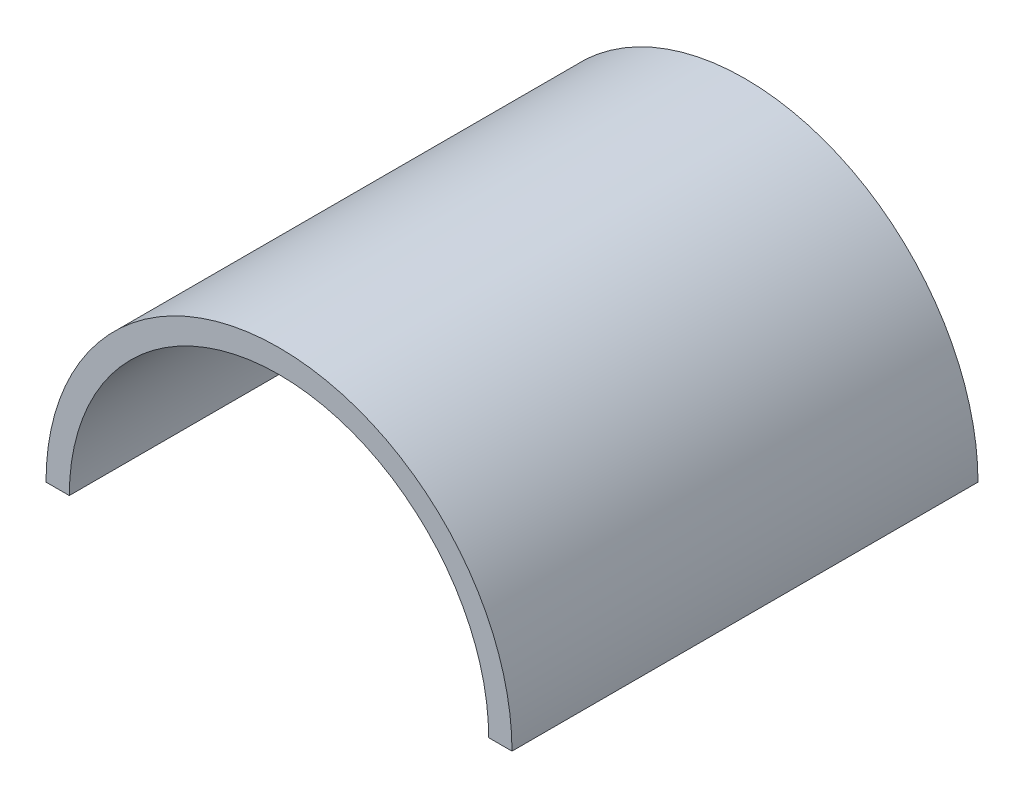
from build123d import *

# Parameters (mm, degrees)
BOSS_EXTRU_2_DEPTH = 50


with BuildPart() as part:
    # Esquisse2 → Boss.-Extru.2 (new body)
    with BuildSketch(Plane.XY):
        with BuildLine():
            ThreePointArc((-22.5, 0), (0, 22.5), (22.5, 0))
            Line((22.5, 0), (25, 0))
            ThreePointArc((25, 0), (0, 25), (-25, 0))
            Line((-25, 0), (-22.5, 0))
        make_face()
    extrude(amount=BOSS_EXTRU_2_DEPTH)


solid = part.part
